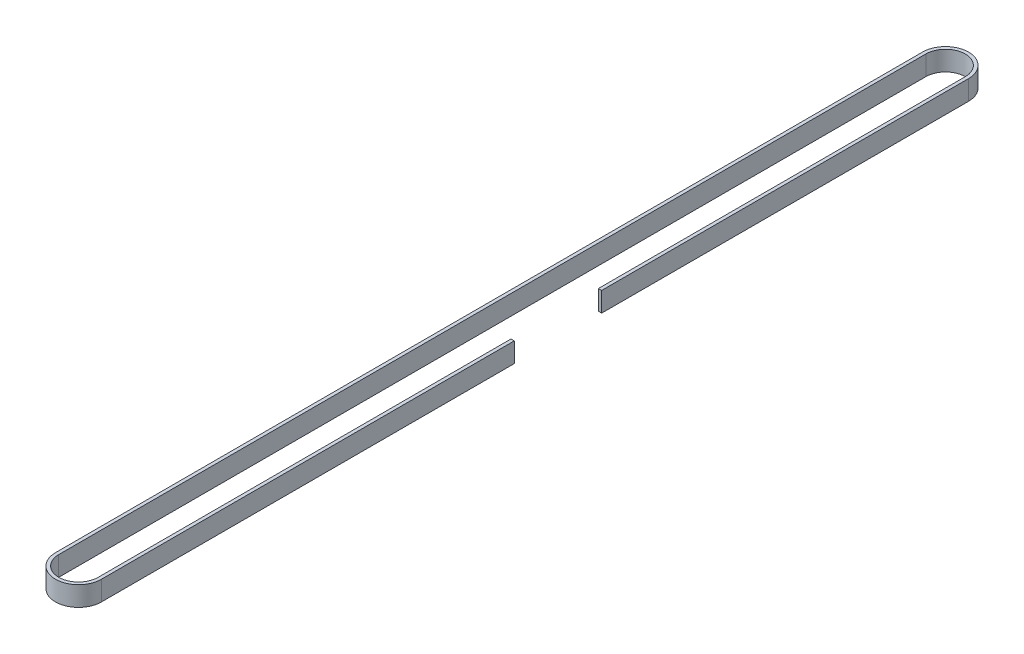
from build123d import *

# Parameters (mm, degrees)
BOSS_EXTRUDE1_DEPTH = 6


with BuildPart() as part:
    # Sketch2 → Boss-Extrude1 (new body)
    with BuildSketch(Plane(origin=(0, 0, 0), x_dir=(1, 0, 0), z_dir=(0, 1, 0))):
        with BuildLine():
            Line((-6, -125), (-6, 139))
            ThreePointArc((-6, 139), (0, 145), (6, 139))
            Line((6, 139), (6, 27.304495783))
            Line((6, 27.304495783), (7, 27.304495783))
            Line((7, 27.304495783), (7, 139))
            ThreePointArc((7, 139), (0, 146), (-7, 139))
            Line((-7, 139), (-7, -125))
            ThreePointArc((-7, -125), (0, -132), (7, -125))
            Line((7, -125), (7, 0.695504217))
            Line((7, 0.695504217), (6, 0.695504217))
            Line((6, 0.695504217), (6, -125))
            ThreePointArc((6, -125), (0, -131), (-6, -125))
        make_face()
    extrude(amount=BOSS_EXTRUDE1_DEPTH)


solid = part.part
